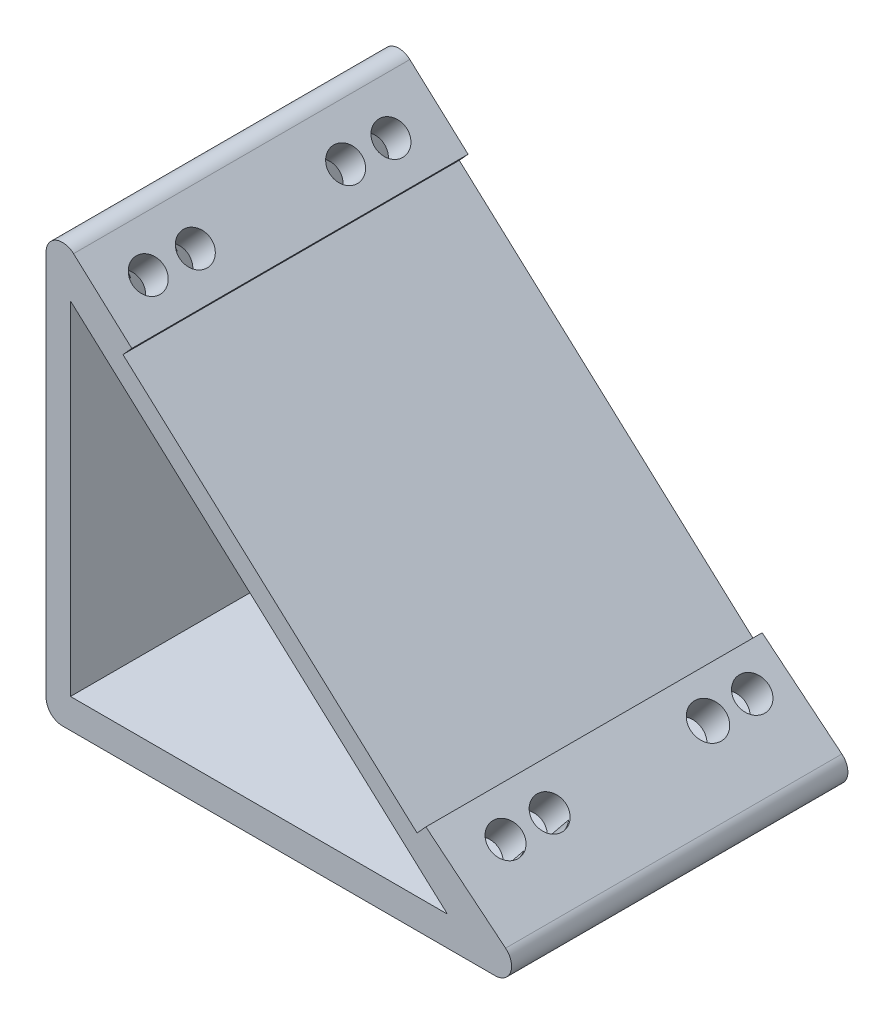
from build123d import *

# Parameters (mm, degrees)
BOSS_EXTRUDE2_DEPTH = 52.07
FILLET1_R           = 2.54
FILLET2_R           = 2.54
SKETCH2_R           = 2.487911977
CUT_EXTRUDE1_DEPTH  = 6.35
SKETCH3_R           = 2.511508717
CUT_EXTRUDE2_DEPTH  = 6.35
SKETCH4_R           = 2.535513074
SKETCH4_R_2         = 2.663596319
CUT_EXTRUDE3_DEPTH  = 6.35


with BuildPart() as part:
    # Sketch1 → Boss-Extrude2 (new body)
    with BuildSketch(Plane.XY):
        Polygon((-26.962285336, 42.108267604), (-26.962285336, -25.93406259), (49.683796158, -25.93406259), (31.840285665, -11.333620206), (30.474759276, -12.836120693), (-15.063657258, 28.550827293), (-13.698130869, 30.053327779), align=None)
        Polygon((-23.192135268, -21.36418372), (-23.192135268, 31.68438668), (35.177665187, -21.36418372), align=None, mode=Mode.SUBTRACT)
    extrude(amount=BOSS_EXTRUDE2_DEPTH)

    # Fillet1
    fillet1_edges = [part.edges().sort_by_distance(p)[0] for p in [
        (49.683796158, -25.93406259, 26.035),
        (-26.962285336, 42.108267604, 26.035),
    ]]
    fillet(fillet1_edges, radius=FILLET1_R)

    # Fillet2
    fillet2_edges = [part.edges().sort_by_distance(p)[0] for p in [
        (-26.962285336, -25.93406259, 26.035),
    ]]
    fillet(fillet2_edges, radius=FILLET2_R)

    # Sketch2 → Cut-Extrude1 (cut)
    with BuildSketch(Plane(origin=(8.761925392, 9.640822229, 0), x_dir=(0.7400339952176945, -0.6725694654993916, 0), z_dir=(0.6725694654993916, 0.7400339952176945, 0))):
        with Locations(Location((-36.410725244, -45.039764093, 0), (0, 0, 180))):
            Circle(SKETCH2_R)
        with Locations(Location((-36.342932428, -37.794805414, 0), (0, 0, 180))):
            Circle(SKETCH2_R)
        with Locations(Location((-36.113890977, -14.695763967, 0), (0, 0, 180))):
            Circle(SKETCH2_R)
        with Locations(Location((-36.113890977, -7.677508428, 0), (0, 0, 180))):
            Circle(SKETCH2_R)
        with Locations(Location((38.19748483, -45.003751016, 0), (0, 0, 180))):
            Circle(SKETCH2_R)
        with Locations(Location((38.265277646, -37.758792337, 0), (0, 0, 180))):
            Circle(SKETCH2_R)
        with Locations(Location((38.494319097, -14.659750891, 0), (0, 0, 180))):
            Circle(SKETCH2_R)
        with Locations(Location((38.494319097, -7.641495351, 0), (0, 0, 180))):
            Circle(SKETCH2_R)
    extrude(amount=-CUT_EXTRUDE1_DEPTH, mode=Mode.SUBTRACT)

    # Sketch3 → Cut-Extrude2 (cut)
    with BuildSketch(Plane(origin=(7.214216448, 8.816647023, 0), x_dir=(0.773931651192209, -0.6332691365311442, 0), z_dir=(0.6332691365311442, 0.773931651192209, 0))):
        with Locations(Location((37.297632804, -37.151246131, 0), (0, 0, 180))):
            Circle(SKETCH3_R)
        with Locations(Location((37.407323838, -44.063868687, 0), (0, 0, 180))):
            Circle(SKETCH3_R)
    extrude(amount=-CUT_EXTRUDE2_DEPTH, mode=Mode.SUBTRACT)

    # Sketch4 → Cut-Extrude3 (cut)
    with BuildSketch(Plane(origin=(7.214216448, 8.816647023, 0), x_dir=(0.773931651192209, -0.6332691365311442, 0), z_dir=(0.6332691365311442, 0.773931651192209, 0))):
        with Locations(Location((37.100504768, -5.630572581, 0), (0, 0, 180))):
            Circle(SKETCH4_R)
        with Locations(Location((37.232498306, -12.582232269, 0), (0, 0, 180))):
            Circle(SKETCH4_R_2)
    extrude(amount=-CUT_EXTRUDE3_DEPTH, mode=Mode.SUBTRACT)


solid = part.part
